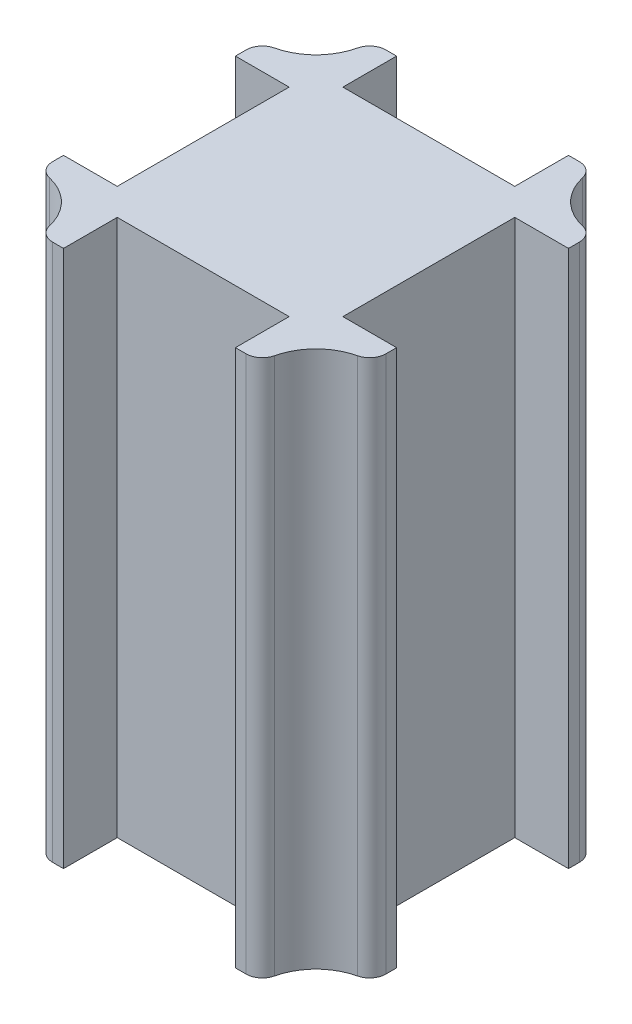
from build123d import *

# Parameters (mm, degrees)
SKETCH5_W           = 31
SKETCH5_H           = 31
BOSS_EXTRUDE2_DEPTH = 50
SKETCH6_W           = 5
SKETCH6_H           = 16
CUT_EXTRUDE1_DEPTH  = 50
CIRPATTERN1_COUNT   = 4
SKETCH7_R           = 5.164102758
CUT_EXTRUDE2_DEPTH  = 50
CIRPATTERN2_COUNT   = 4
FILLET1_R           = 1.5
SKETCH8_R           = 4.25
CUT_EXTRUDE3_DEPTH  = 1.5


with BuildPart() as part:
    # Sketch5 → Boss-Extrude2 (new body)
    with BuildSketch(Plane(origin=(0, 3, 0), x_dir=(1, 0, 0), z_dir=(0, 1, 0))):
        Rectangle(SKETCH5_W, SKETCH5_H)
    extrude(amount=BOSS_EXTRUDE2_DEPTH)

    # Sketch6 → Cut-Extrude1 (cut)
    with BuildSketch(Plane(origin=(0, 53, 0), x_dir=(1, 0, 0), z_dir=(0, 1, 0))):
        with Locations((-13, 0)):
            Rectangle(SKETCH6_W, SKETCH6_H)
    cut_extrude1 = extrude(amount=-CUT_EXTRUDE1_DEPTH, mode=Mode.SUBTRACT)

    # CirPattern1: Cut-Extrude1 ×4 about axis
    cirpattern1_axis = Axis((0, 0, 0), (0, 1, 0))
    for i in range(1, CIRPATTERN1_COUNT):
        add(cut_extrude1.rotate(cirpattern1_axis, i * 360 / CIRPATTERN1_COUNT), mode=Mode.SUBTRACT)

    # Sketch7 → Cut-Extrude2 (cut)
    with BuildSketch(Plane(origin=(0, 53, 0), x_dir=(1, 0, 0), z_dir=(0, 1, 0))):
        with Locations((-15.5, -15.5)):
            Circle(SKETCH7_R)
    cut_extrude2 = extrude(amount=-CUT_EXTRUDE2_DEPTH, mode=Mode.SUBTRACT)

    # CirPattern2: Cut-Extrude2 ×4 about axis
    cirpattern2_axis = Axis((0, 0, 0), (0, 1, 0))
    for i in range(1, CIRPATTERN2_COUNT):
        add(cut_extrude2.rotate(cirpattern2_axis, i * 360 / CIRPATTERN2_COUNT), mode=Mode.SUBTRACT)

    # Fillet1
    fillet1_edges = [part.edges().sort_by_distance(p)[0] for p in [
        (-15.5, 28, -10.335897242),
        (-10.335897242, 28, -15.5),
        (10.335897242, 28, -15.5),
        (15.5, 28, -10.335897242),
        (15.5, 28, 10.335897242),
        (10.335897242, 28, 15.5),
        (-10.335897242, 28, 15.5),
        (-15.5, 28, 10.335897242),
    ]]
    fillet(fillet1_edges, radius=FILLET1_R)

    # Sketch8 → Cut-Extrude3 (cut)
    with BuildSketch(Plane.XZ.offset(-3)):
        Circle(SKETCH8_R)
    extrude(amount=-CUT_EXTRUDE3_DEPTH, mode=Mode.SUBTRACT)


solid = part.part
